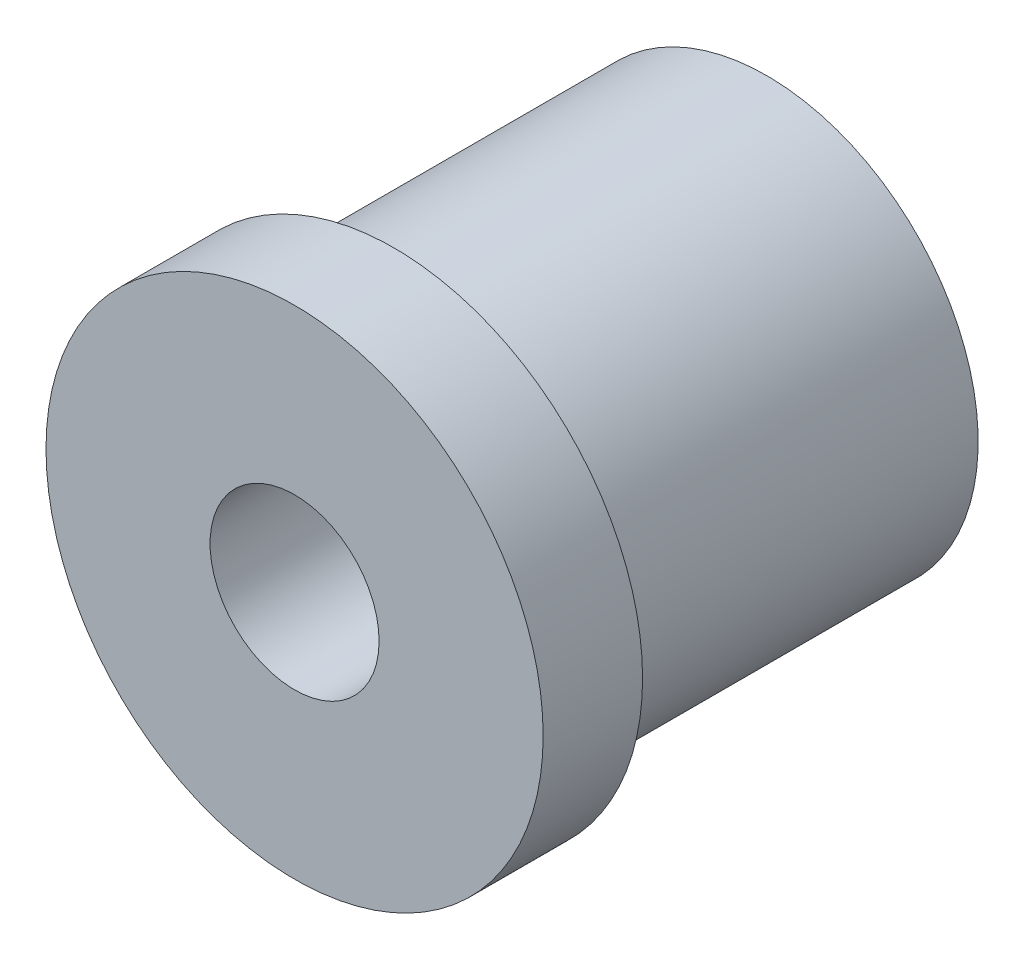
from build123d import *

# Parameters (mm, degrees)
SKETCH1_R              = 10
BOSS_EXTRUDE1_DEPTH    = 4
SKETCH2_R              = 8.5
BOSS_EXTRUDE2_DEPTH    = 15
M8X1_25_TAPPED_HOLE2_D = 6.8


with BuildPart() as part:
    # Sketch1 → Boss-Extrude1 (new body)
    with BuildSketch(Plane.XY):
        Circle(SKETCH1_R)
    extrude(amount=BOSS_EXTRUDE1_DEPTH)

    # Sketch2 → Boss-Extrude2 (add)
    with BuildSketch(Plane(origin=(0, 0, 0), x_dir=(-1, 0, 0), z_dir=(0, 0, -1))):
        Circle(SKETCH2_R)
    extrude(amount=BOSS_EXTRUDE2_DEPTH)

    # M8x1.25 Tapped Hole2 (through all)
    with Locations(Plane.XY.offset(4)):
        with Locations((0, 0)):
            Hole(M8X1_25_TAPPED_HOLE2_D / 2)


solid = part.part
